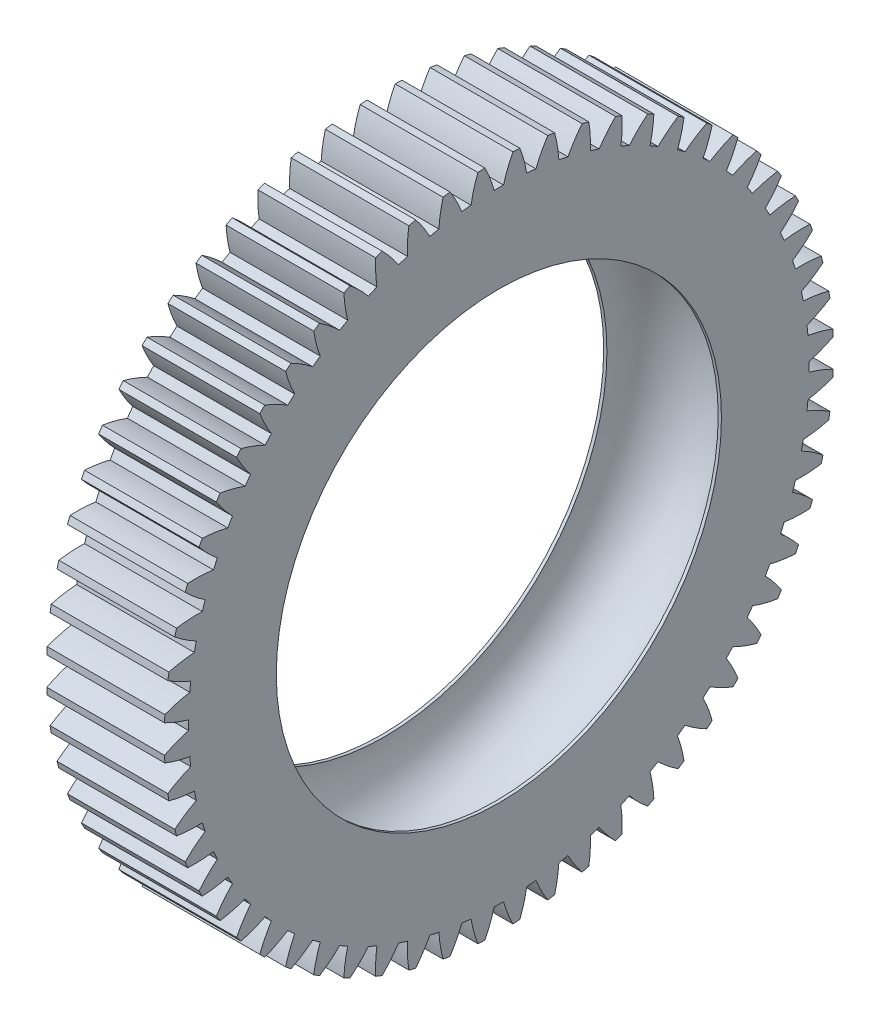
from build123d import *

# Parameters (mm, degrees)
BASPROSKE_W             = 7
BASPROSKE_H             = 15.5
TOOTHCUT_DEPTH          = 24.010866998
TEETHCUTS_COUNT         = 60
TEETHCUTS_ANGLE         = 354
BORSKE_R                = 10
BORE_DEPTH              = 50.0000508
SCALE1_SCALE            = 0.97
CUT_EXTRUDE1_DEPTH      = 3
CUT_EXTRUDE1_DEPTH_BACK = 31
SKETCH1_R               = 10
CUT_SWEEP2_PROFILE_R    = 2.5
SKETCH19_R              = 21.106047463
CUT_EXTRUDE2_DEPTH      = 0.75
SKETCH21_R              = 17.763202132
CUT_EXTRUDE3_DEPTH      = 0.75


with BuildPart() as part:
    # BasProSke → Base-Revolve (revolve)
    with BuildSketch(Plane(origin=(0, 0, 0), x_dir=(1, 0, 0), z_dir=(0, 1, 0))):
        with Locations((3.5, 7.75)):
            Rectangle(BASPROSKE_W, BASPROSKE_H)
    revolve(axis=Axis((-10, 0, 0), (1, 0, 0)))

    # TooCutSke → ToothCut (cut, through all)
    with BuildSketch(Plane(origin=(0, 0, 0), x_dir=(0, 0, -1), z_dir=(1, 0, 0))):
        with BuildLine():
            ThreePointArc((0.21493681, 14.372392917), (0, 14.374), (-0.21493681, 14.372392917))
            ThreePointArc((-0.21493681, 14.372392917), (-0.409732631, 14.953266942), (-0.662749221, 15.51124781))
            ThreePointArc((-0.662749221, 15.51124781), (0, 15.5254), (0.662749221, 15.51124781))
            ThreePointArc((0.662749221, 15.51124781), (0.409732631, 14.953266942), (0.21493681, 14.372392917))
        make_face()
    toothcut = extrude(amount=TOOTHCUT_DEPTH, mode=Mode.SUBTRACT)

    # TeethCuts: ToothCut ×60 about axis
    teethcuts_axis = Axis((-10, 0, 0), (1, 0, 0))
    for i in range(1, TEETHCUTS_COUNT):
        add(toothcut.rotate(teethcuts_axis, i * TEETHCUTS_ANGLE / (TEETHCUTS_COUNT - 1)), mode=Mode.SUBTRACT)

    # BorSke → Bore (cut, symmetric)
    with BuildSketch(Plane(origin=(0, 0, 0), x_dir=(0, 0, -1), z_dir=(1, 0, 0))):
        Circle(BORSKE_R)
    extrude(amount=BORE_DEPTH, both=True, mode=Mode.SUBTRACT)


with BuildPart() as part_1:
    # Scale1: scaled about (3.5, 0, 0)
    add(part.part.scale(SCALE1_SCALE).moved(Location((0.105, 0, 0))))

    # Sketch1 → Cut-Extrude1 (cut, two sides: drawn at the far end of the back side and taken through both)
    with BuildSketch(Plane(origin=(6.895, 0, 0), x_dir=(0, 0, -1), z_dir=(1, 0, 0)).offset(-CUT_EXTRUDE1_DEPTH_BACK)):
        Circle(SKETCH1_R)
    extrude(amount=CUT_EXTRUDE1_DEPTH + CUT_EXTRUDE1_DEPTH_BACK, mode=Mode.SUBTRACT)

    # Cut-Sweep2: sweep along a path in Sketch11
    with BuildLine(Plane(origin=(3.5, 0, 0), x_dir=(0, 0, -1), z_dir=(1, 0, 0))) as cut_sweep2_path:
        CenterArc((0, 0), 10, 0, 360)
    # Cut-Sweep2 profile (on start of the path) → Cut-Sweep2 (sweep, cut)
    with BuildSketch(Plane(origin=(3.5, 0, -10), x_dir=(0, 0, 1), z_dir=(0, 1, 0))):
        Circle(CUT_SWEEP2_PROFILE_R)
    sweep(path=cut_sweep2_path.line, mode=Mode.SUBTRACT)

    # Sketch19 → Cut-Extrude2 (cut)
    with BuildSketch(Plane(origin=(6.895, 0, 0), x_dir=(0, 0, -1), z_dir=(1, 0, 0))):
        Circle(SKETCH19_R)
    extrude(amount=-CUT_EXTRUDE2_DEPTH, mode=Mode.SUBTRACT)

    # Sketch21 → Cut-Extrude3 (cut)
    with BuildSketch(Plane.ZY.offset(-0.105)):
        Circle(SKETCH21_R)
    extrude(amount=-CUT_EXTRUDE3_DEPTH, mode=Mode.SUBTRACT)


solid = part_1.part
